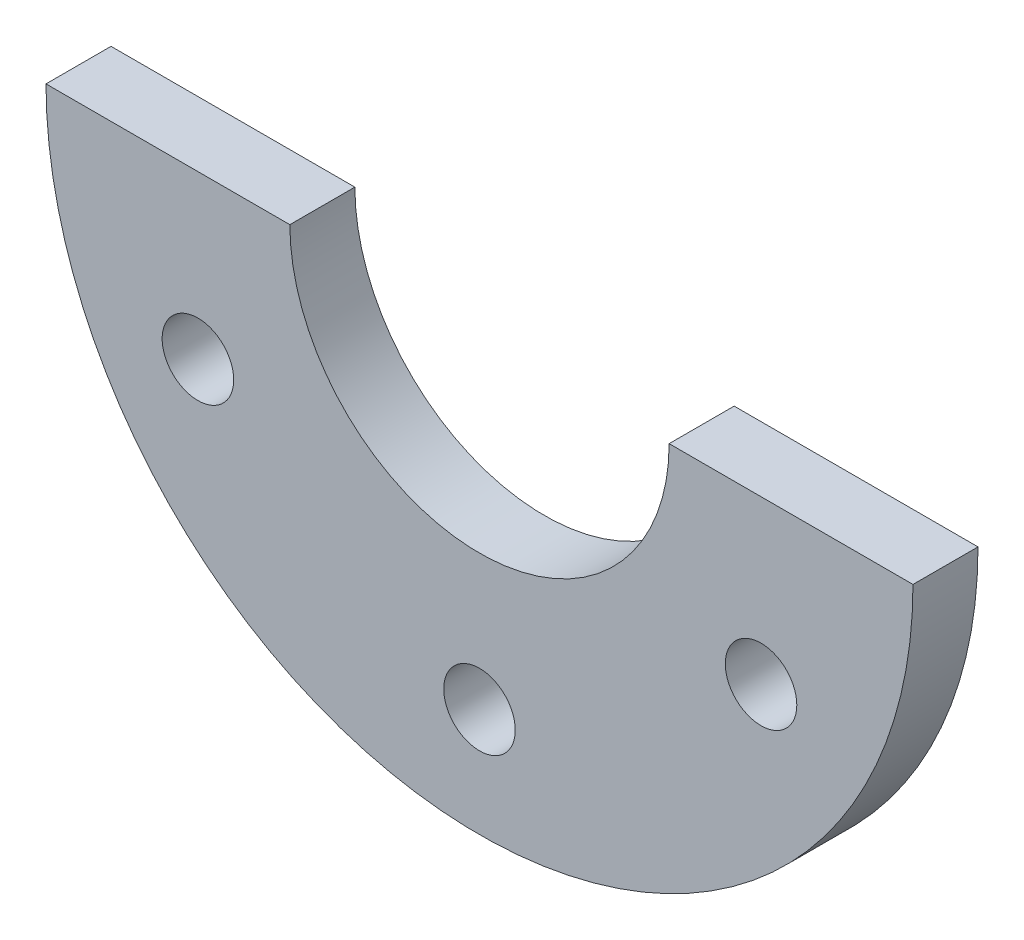
from build123d import *

# Parameters (mm, degrees)
BOSS_EXTRUDE1_DEPTH = 6
SKETCH2_R           = 3.3
CUT_EXTRUDE2_DEPTH  = 57.885850613


with BuildPart() as part:
    # Sketch1 → Boss-Extrude1 (new body)
    with BuildSketch(Plane.XY):
        with BuildLine():
            Line((17.5, 0), (40, 0))
            ThreePointArc((40, 0), (0, -40), (-40, 0))
            Line((-40, 0), (-17.5, 0))
            ThreePointArc((-17.5, 0), (0, -17.5), (17.5, 0))
        make_face()
    extrude(amount=BOSS_EXTRUDE1_DEPTH)

    # Sketch2 → Cut-Extrude2 (cut, through all)
    with BuildSketch(Plane.XY):
        with Locations((0, -30)):
            Circle(SKETCH2_R)
        with Locations((-25.980762114, -15)):
            Circle(SKETCH2_R)
        with Locations((25.980762114, -15)):
            Circle(SKETCH2_R)
    extrude(amount=CUT_EXTRUDE2_DEPTH, mode=Mode.SUBTRACT)


solid = part.part
